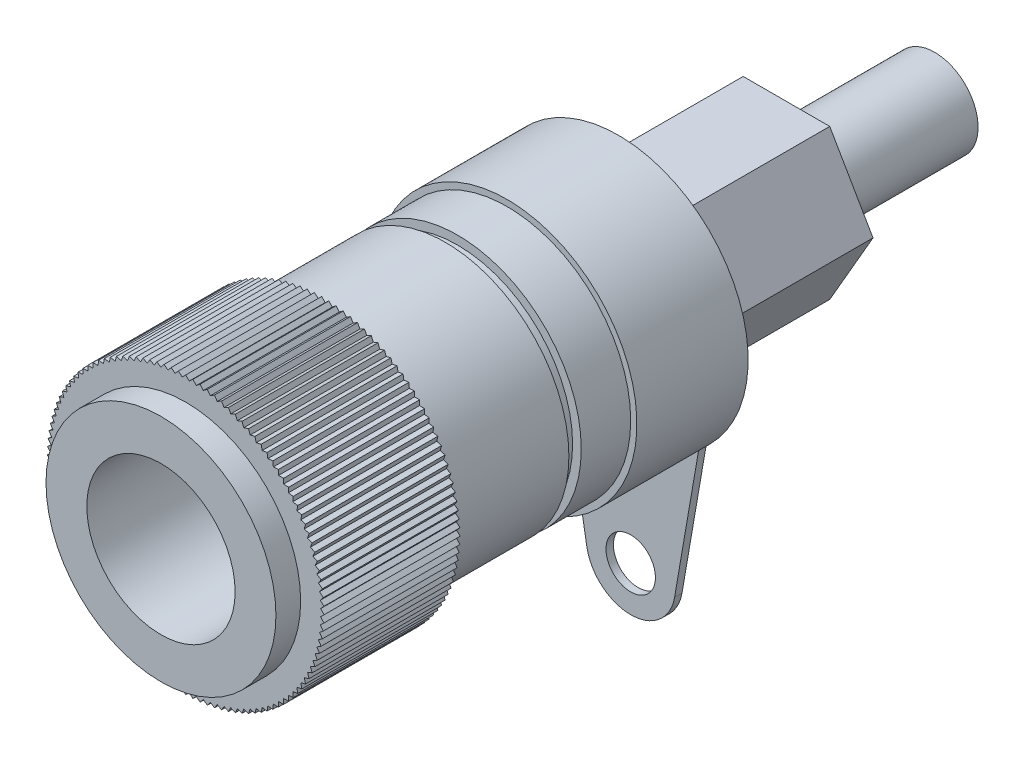
from build123d import *

# Parameters (mm, degrees)
CROQUIS2_R               = 4.65
CROQUIS2_R_2             = 3
SALIENTE_EXTRUIR1_DEPTH  = 1
CROQUIS3_R               = 3
SALIENTE_EXTRUIR2_DEPTH  = 5.5
CROQUIS4_R               = 5
CROQUIS4_R_2             = 1.75
SALIENTE_EXTRUIR3_DEPTH  = 5
CROQUIS5_R               = 4.65
CROQUIS5_R_2             = 1.75
SALIENTE_EXTRUIR4_DEPTH  = 0.5
CROQUIS6_R               = 5
CROQUIS6_R_2             = 1.75
SALIENTE_EXTRUIR5_DEPTH  = 2
CROQUIS7_R               = 5.25
CROQUIS7_R_2             = 1.75
SALIENTE_EXTRUIR6_DEPTH  = 4.5
CROQUIS8_R               = 4.5
SALIENTE_EXTRUIR7_DEPTH  = 0.5
CROQUIS9_R               = 1
SALIENTE_EXTRUIR8_DEPTH  = 0.3
SALIENTE_EXTRUIR9_DEPTH  = 6
CROQUIS11_R              = 1.75
SALIENTE_EXTRUIR10_DEPTH = 6


with BuildPart() as part:
    # Croquis2 → Saliente-Extruir1 (new body)
    with BuildSketch(Plane.XY):
        Circle(CROQUIS2_R)
        Circle(CROQUIS2_R_2, mode=Mode.SUBTRACT)
    extrude(amount=-SALIENTE_EXTRUIR1_DEPTH)

    # Croquis3 → Saliente-Extruir2 (add)
    with BuildSketch(Plane(origin=(0, 0, -1), x_dir=(-1, 0, 0), z_dir=(0, 0, -1))):
        Polygon((0.142899213, 5.457100787), (0, 5.6), (-0.142899213, 5.457100787), (-0.293081355, 5.592325395), (-0.428305963, 5.442143253), (-0.585359394, 5.569322614), (-0.712538755, 5.412269183), (-0.876033004, 5.531054707), (-0.994818529, 5.367560459), (-1.164305469, 5.477626564), (-1.274371574, 5.308139625), (-1.449386653, 5.409184627), (-1.550431655, 5.234169549), (-1.730495168, 5.325916491), (-1.822242111, 5.145852978), (-2.006860517, 5.228050388), (-2.089057928, 5.043431982), (-2.277725201, 5.115854563), (-2.350147782, 4.927187289), (-2.542346799, 4.989636535), (-2.604796045, 4.797437519), (-2.8, 4.849742261), (-2.852304742, 4.654538306), (-3.049978596, 4.69655518), (-3.091995471, 4.498881327), (-3.291597413, 4.530495168), (-3.323211255, 4.330893226), (-3.52419419, 4.352017384), (-3.545318348, 4.151034449), (-3.747131396, 4.161611023), (-3.757707969, 3.959797975), (-3.959797975, 3.959797975), (-3.959797975, 3.757707969), (-4.161611023, 3.747131396), (-4.151034449, 3.545318348), (-4.352017384, 3.52419419), (-4.330893226, 3.323211255), (-4.530495168, 3.291597413), (-4.498881327, 3.091995471), (-4.69655518, 3.049978596), (-4.654538306, 2.852304742), (-4.849742261, 2.8), (-4.797437519, 2.604796045), (-4.989636535, 2.542346799), (-4.927187289, 2.350147782), (-5.115854563, 2.277725201), (-5.043431982, 2.089057928), (-5.228050388, 2.006860517), (-5.145852978, 1.822242111), (-5.325916491, 1.730495168), (-5.234169549, 1.550431655), (-5.409184627, 1.449386653), (-5.308139625, 1.274371574), (-5.477626564, 1.164305469), (-5.367560459, 0.994818529), (-5.531054707, 0.876033004), (-5.412269183, 0.712538755), (-5.569322614, 0.585359394), (-5.442143253, 0.428305963), (-5.592325395, 0.293081355), (-5.457100787, 0.142899213), (-5.6, 0), (-5.457100787, -0.142899213), (-5.592325395, -0.293081355), (-5.442143253, -0.428305963), (-5.569322614, -0.585359394), (-5.412269183, -0.712538755), (-5.531054707, -0.876033004), (-5.367560459, -0.994818529), (-5.477626564, -1.164305469), (-5.308139625, -1.274371574), (-5.409184627, -1.449386653), (-5.234169549, -1.550431655), (-5.325916491, -1.730495168), (-5.145852978, -1.822242111), (-5.228050388, -2.006860517), (-5.043431982, -2.089057928), (-5.115854563, -2.277725201), (-4.927187289, -2.350147782), (-4.989636535, -2.542346799), (-4.797437519, -2.604796045), (-4.849742261, -2.8), (-4.654538306, -2.852304742), (-4.69655518, -3.049978596), (-4.498881327, -3.091995471), (-4.530495168, -3.291597413), (-4.330893226, -3.323211255), (-4.352017384, -3.52419419), (-4.151034449, -3.545318348), (-4.161611023, -3.747131396), (-3.959797975, -3.757707969), (-3.959797975, -3.959797975), (-3.757707969, -3.959797975), (-3.747131396, -4.161611023), (-3.545318348, -4.151034449), (-3.52419419, -4.352017384), (-3.323211255, -4.330893226), (-3.291597413, -4.530495168), (-3.091995471, -4.498881327), (-3.049978596, -4.69655518), (-2.852304742, -4.654538306), (-2.8, -4.849742261), (-2.604796045, -4.797437519), (-2.542346799, -4.989636535), (-2.350147782, -4.927187289), (-2.277725201, -5.115854563), (-2.089057928, -5.043431982), (-2.006860517, -5.228050388), (-1.822242111, -5.145852978), (-1.730495168, -5.325916491), (-1.550431655, -5.234169549), (-1.449386653, -5.409184627), (-1.274371574, -5.308139625), (-1.164305469, -5.477626564), (-0.994818529, -5.367560459), (-0.876033004, -5.531054707), (-0.712538755, -5.412269183), (-0.585359394, -5.569322614), (-0.428305963, -5.442143253), (-0.293081355, -5.592325395), (-0.142899213, -5.457100787), (0, -5.6), (0.142899213, -5.457100787), (0.293081355, -5.592325395), (0.428305963, -5.442143253), (0.585359394, -5.569322614), (0.712538755, -5.412269183), (0.876033004, -5.531054707), (0.994818529, -5.367560459), (1.164305469, -5.477626564), (1.274371574, -5.308139625), (1.449386653, -5.409184627), (1.550431655, -5.234169549), (1.730495168, -5.325916491), (1.822242111, -5.145852978), (2.006860517, -5.228050388), (2.089057928, -5.043431982), (2.277725201, -5.115854563), (2.350147782, -4.927187289), (2.542346799, -4.989636535), (2.604796045, -4.797437519), (2.8, -4.849742261), (2.852304742, -4.654538306), (3.049978596, -4.69655518), (3.091995471, -4.498881327), (3.291597413, -4.530495168), (3.323211255, -4.330893226), (3.52419419, -4.352017384), (3.545318348, -4.151034449), (3.747131396, -4.161611023), (3.757707969, -3.959797975), (3.959797975, -3.959797975), (3.959797975, -3.757707969), (4.161611023, -3.747131396), (4.151034449, -3.545318348), (4.352017384, -3.52419419), (4.330893226, -3.323211255), (4.530495168, -3.291597413), (4.498881327, -3.091995471), (4.69655518, -3.049978596), (4.654538306, -2.852304742), (4.849742261, -2.8), (4.797437519, -2.604796045), (4.989636535, -2.542346799), (4.927187289, -2.350147782), (5.115854563, -2.277725201), (5.043431982, -2.089057928), (5.228050388, -2.006860517), (5.145852978, -1.822242111), (5.325916491, -1.730495168), (5.234169549, -1.550431655), (5.409184627, -1.449386653), (5.308139625, -1.274371574), (5.477626564, -1.164305469), (5.367560459, -0.994818529), (5.531054707, -0.876033004), (5.412269183, -0.712538755), (5.569322614, -0.585359394), (5.442143253, -0.428305963), (5.592325395, -0.293081355), (5.457100787, -0.142899213), (5.6, 0), (5.457100787, 0.142899213), (5.592325395, 0.293081355), (5.442143253, 0.428305963), (5.569322614, 0.585359394), (5.412269183, 0.712538755), (5.531054707, 0.876033004), (5.367560459, 0.994818529), (5.477626564, 1.164305469), (5.308139625, 1.274371574), (5.409184627, 1.449386653), (5.234169549, 1.550431655), (5.325916491, 1.730495168), (5.145852978, 1.822242111), (5.228050388, 2.006860517), (5.043431982, 2.089057928), (5.115854563, 2.277725201), (4.927187289, 2.350147782), (4.989636535, 2.542346799), (4.797437519, 2.604796045), (4.849742261, 2.8), (4.654538306, 2.852304742), (4.69655518, 3.049978596), (4.498881327, 3.091995471), (4.530495168, 3.291597413), (4.330893226, 3.323211255), (4.352017384, 3.52419419), (4.151034449, 3.545318348), (4.161611023, 3.747131396), (3.959797975, 3.757707969), (3.959797975, 3.959797975), (3.757707969, 3.959797975), (3.747131396, 4.161611023), (3.545318348, 4.151034449), (3.52419419, 4.352017384), (3.323211255, 4.330893226), (3.291597413, 4.530495168), (3.091995471, 4.498881327), (3.049978596, 4.69655518), (2.852304742, 4.654538306), (2.8, 4.849742261), (2.604796045, 4.797437519), (2.542346799, 4.989636535), (2.350147782, 4.927187289), (2.277725201, 5.115854563), (2.089057928, 5.043431982), (2.006860517, 5.228050388), (1.822242111, 5.145852978), (1.730495168, 5.325916491), (1.550431655, 5.234169549), (1.449386653, 5.409184627), (1.274371574, 5.308139625), (1.164305469, 5.477626564), (0.994818529, 5.367560459), (0.876033004, 5.531054707), (0.712538755, 5.412269183), (0.585359394, 5.569322614), (0.428305963, 5.442143253), (0.293081355, 5.592325395), align=None)
        with Locations(Location((0, 0, 0), (0, 0, 180))):
            Circle(CROQUIS3_R, mode=Mode.SUBTRACT)
    extrude(amount=SALIENTE_EXTRUIR2_DEPTH)

    # Croquis4 → Saliente-Extruir3 (add)
    with BuildSketch(Plane(origin=(0, 0, -6.5), x_dir=(-1, 0, 0), z_dir=(0, 0, -1))):
        Circle(CROQUIS4_R)
        Circle(CROQUIS4_R_2, mode=Mode.SUBTRACT)
    extrude(amount=SALIENTE_EXTRUIR3_DEPTH)

    # Croquis5 → Saliente-Extruir4 (add)
    with BuildSketch(Plane(origin=(0, 0, -11.5), x_dir=(-1, 0, 0), z_dir=(0, 0, -1))):
        with Locations(Location((0, 0, 0), (0, 0, 180))):
            Circle(CROQUIS5_R)
        Circle(CROQUIS5_R_2, mode=Mode.SUBTRACT)
    extrude(amount=SALIENTE_EXTRUIR4_DEPTH)

    # Croquis6 → Saliente-Extruir5 (add)
    with BuildSketch(Plane(origin=(0, 0, -12), x_dir=(-1, 0, 0), z_dir=(0, 0, -1))):
        Circle(CROQUIS6_R)
        Circle(CROQUIS6_R_2, mode=Mode.SUBTRACT)
    extrude(amount=SALIENTE_EXTRUIR5_DEPTH)

    # Croquis7 → Saliente-Extruir6 (add)
    with BuildSketch(Plane(origin=(0, 0, -14), x_dir=(-1, 0, 0), z_dir=(0, 0, -1))):
        Circle(CROQUIS7_R)
        Circle(CROQUIS7_R_2, mode=Mode.SUBTRACT)
    extrude(amount=SALIENTE_EXTRUIR6_DEPTH)

    # Croquis8 → Saliente-Extruir7 (add)
    with BuildSketch(Plane(origin=(0, 0, -18.5), x_dir=(-1, 0, 0), z_dir=(0, 0, -1))):
        Circle(CROQUIS8_R)
    extrude(amount=SALIENTE_EXTRUIR7_DEPTH)

    # Croquis9 → Saliente-Extruir8 (add)
    with BuildSketch(Plane(origin=(0, 0, -19), x_dir=(-1, 0, 0), z_dir=(0, 0, -1))):
        with BuildLine():
            Line((-3.449054218, -0.595), (-1.773799312, -10.306))
            ThreePointArc((-1.773799312, -10.306), (0, -11.8), (1.773799312, -10.306))
            Line((1.773799312, -10.306), (3.449054218, -0.595))
            ThreePointArc((3.449054218, -0.595), (0, 3.5), (-3.449054218, -0.595))
        make_face()
        with Locations((0, -10)):
            Circle(CROQUIS9_R, mode=Mode.SUBTRACT)
    extrude(amount=SALIENTE_EXTRUIR8_DEPTH)

    # Croquis10 → Saliente-Extruir9 (add)
    with BuildSketch(Plane(origin=(0, 0, -19.3), x_dir=(-1, 0, 0), z_dir=(0, 0, -1))):
        Polygon((1.75, -3.031088913), (3.5, 0), (1.75, 3.031088913), (-1.75, 3.031088913), (-3.5, 0), (-1.75, -3.031088913), align=None)
    extrude(amount=SALIENTE_EXTRUIR9_DEPTH)

    # Croquis11 → Saliente-Extruir10 (add)
    with BuildSketch(Plane(origin=(0, 0, -25.3), x_dir=(-1, 0, 0), z_dir=(0, 0, -1))):
        Circle(CROQUIS11_R)
    extrude(amount=SALIENTE_EXTRUIR10_DEPTH)


solid = part.part
